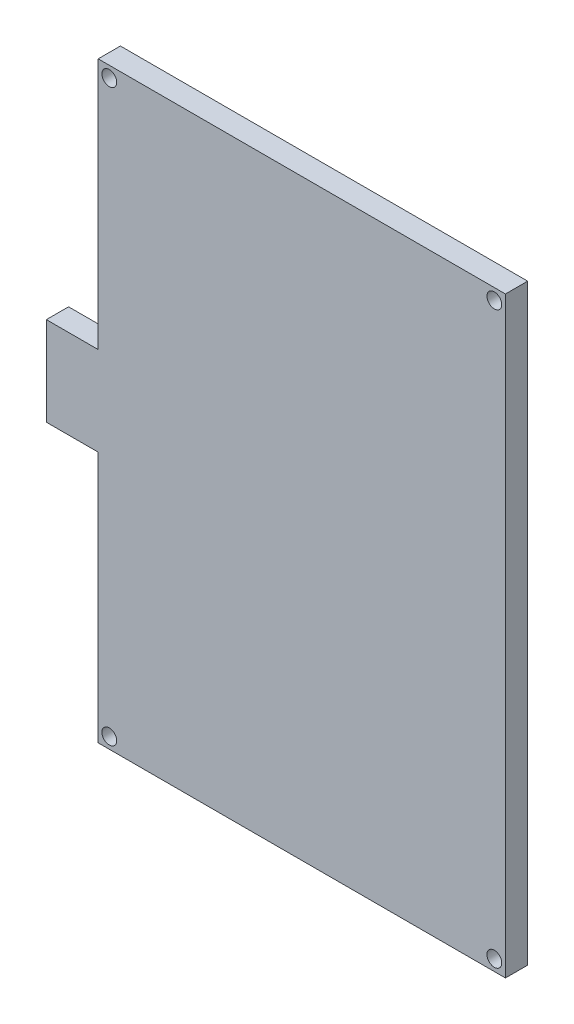
from build123d import *

# Parameters (mm, degrees)
BOSS_EXTRUDE1_DEPTH = 3
SKETCH2_R           = 1
CUT_EXTRUDE1_DEPTH  = 56


with BuildPart() as part:
    # Sketch1 → Boss-Extrude1 (new body)
    with BuildSketch(Plane.XY):
        Polygon((-34.5, -6), (-27.5, -6), (-27.5, -40), (27.5, -40), (27.5, 40), (-27.5, 40), (-27.5, 6), (-34.5, 6), align=None)
    extrude(amount=-BOSS_EXTRUDE1_DEPTH)

    # Sketch2 → Cut-Extrude1 (cut)
    with BuildSketch(Plane.XY):
        with Locations((-26, -38.5)):
            Circle(SKETCH2_R)
        with Locations((26, -38.5)):
            Circle(SKETCH2_R)
        with Locations((26, 38.5)):
            Circle(SKETCH2_R)
        with Locations((-26, 38.5)):
            Circle(SKETCH2_R)
    extrude(amount=-CUT_EXTRUDE1_DEPTH, mode=Mode.SUBTRACT)


solid = part.part
